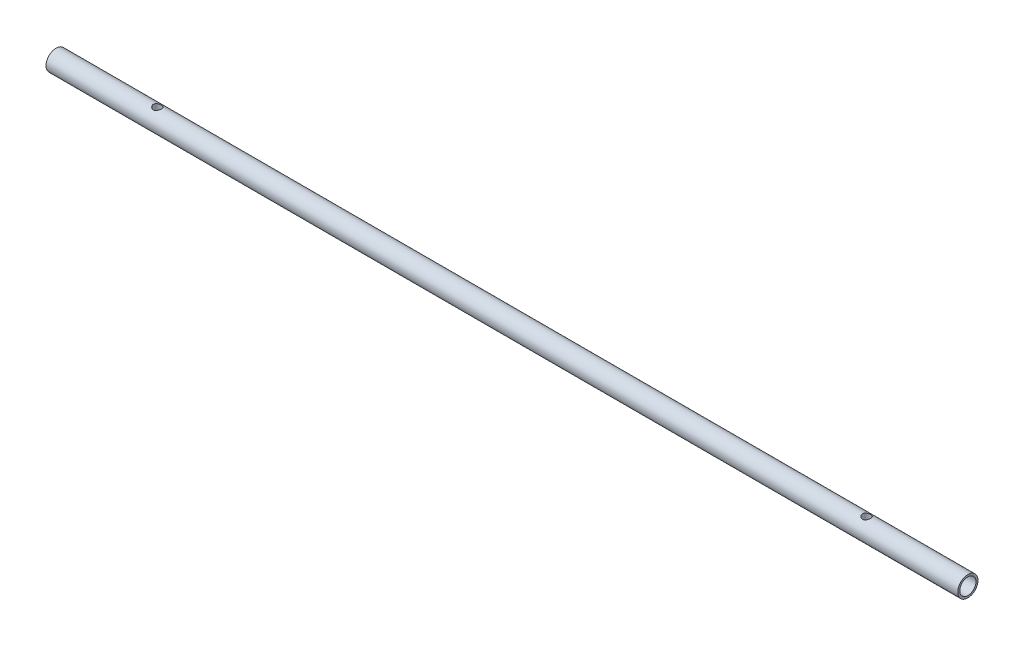
from build123d import *

# Parameters (mm, degrees)
SKETCH1_R               = 10
BOSS_EXTRUDE1_DEPTH     = 900
SKETCH2_R               = 8
CUT_EXTRUDE1_DEPTH      = 40
CUT_EXTRUDE2_START      = -40
SKETCH3_R               = 8
CUT_EXTRUDE2_DEPTH      = 40
CUT_EXTRUDE3_DEPTH      = 40
CUT_EXTRUDE3_DEPTH_BACK = 40
SKETCH4_R               = 4


with BuildPart() as part:
    # Sketch1 → Boss-Extrude1 (new body)
    with BuildSketch(Plane.YZ):
        Circle(SKETCH1_R)
    extrude(amount=BOSS_EXTRUDE1_DEPTH)

    # Sketch2 → Cut-Extrude1 (cut)
    with BuildSketch(Plane.YZ.offset(900)):
        Circle(SKETCH2_R)
    extrude(amount=-CUT_EXTRUDE1_DEPTH, mode=Mode.SUBTRACT)

    # Sketch3 → Cut-Extrude2 (cut)
    with BuildSketch(Plane(origin=(0, 0, 0), x_dir=(0, -1, 0), z_dir=(-1, 0, 0)).offset(CUT_EXTRUDE2_START)):
        Circle(SKETCH3_R)
    extrude(amount=CUT_EXTRUDE2_DEPTH, mode=Mode.SUBTRACT)

    # Sketch4 → Cut-Extrude3 (cut, two sides: drawn at the far end of the back side and taken through both)
    with BuildSketch(Plane(origin=(0, 0, 0), x_dir=(-1, 0, 0), z_dir=(0, 1, 0)).offset(-CUT_EXTRUDE3_DEPTH_BACK)):
        with Locations((-100, 0)):
            Circle(SKETCH4_R)
        with Locations((-800, 0)):
            Circle(SKETCH4_R)
    extrude(amount=CUT_EXTRUDE3_DEPTH + CUT_EXTRUDE3_DEPTH_BACK, mode=Mode.SUBTRACT)


solid = part.part
